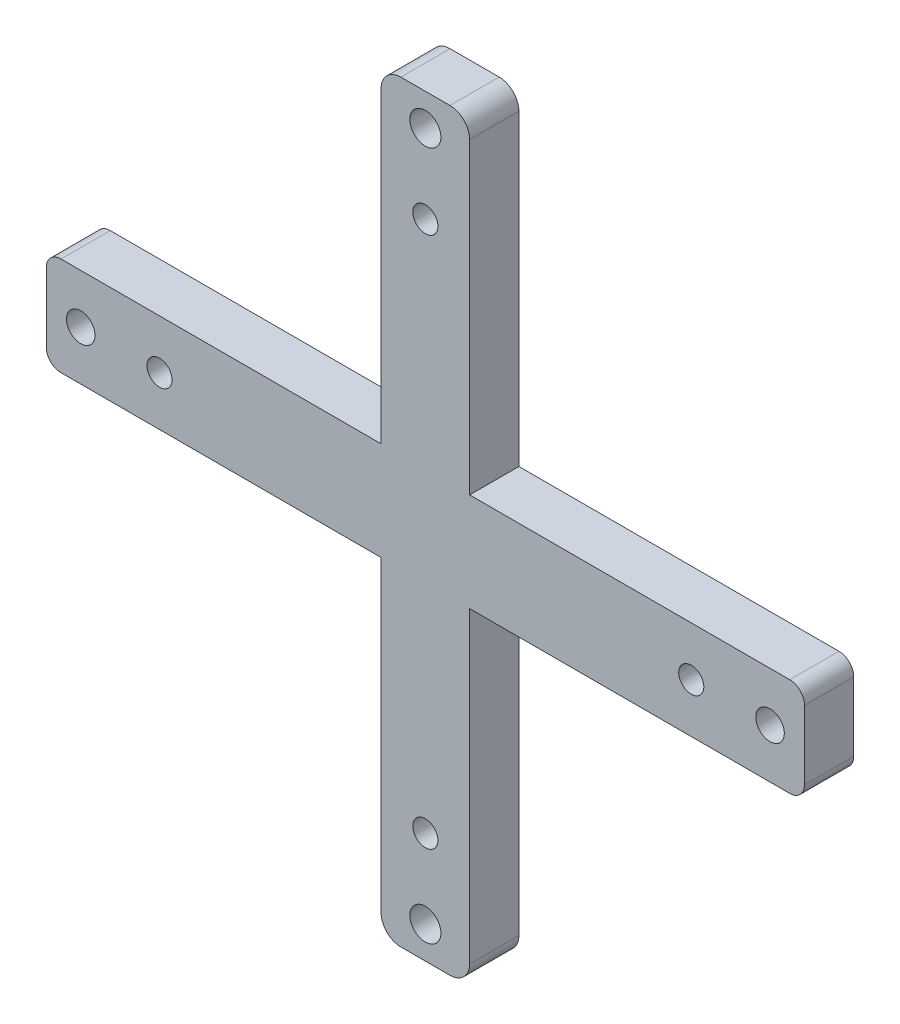
from build123d import *

# Parameters (mm, degrees)
SKETCH1_R           = 3.683
BOSS_EXTRUDE1_DEPTH = 12.7
SKETCH3_R           = 4
BOSS_EXTRUDE3_DEPTH = 12.7
SKETCH2_R           = 3.683
SKETCH2_R_2         = 4
BOSS_EXTRUDE2_DEPTH = 6.35
SKETCH4_R           = 3.2385
CUT_EXTRUDE1_DEPTH  = 139.431456414


with BuildPart() as part:
    # Sketch1 → Boss-Extrude1 (new body)
    with BuildSketch(Plane.XY):
        with BuildLine():
            Line((93.98, -12.7), (-93.98, -12.7))
            ThreePointArc((-93.98, -12.7), (-96.674076836, -11.584076836), (-97.79, -8.89))
            Line((-97.79, -8.89), (-97.79, 8.89))
            ThreePointArc((-97.79, 8.89), (-96.674076836, 11.584076836), (-93.98, 12.7))
            Line((-93.98, 12.7), (93.98, 12.7))
            ThreePointArc((93.98, 12.7), (96.674076836, 11.584076836), (97.79, 8.89))
            Line((97.79, 8.89), (97.79, -8.89))
            ThreePointArc((97.79, -8.89), (96.674076836, -11.584076836), (93.98, -12.7))
        make_face()
        with Locations((-88.9, 0)):
            Circle(SKETCH1_R, mode=Mode.SUBTRACT)
        with Locations((88.9, 0)):
            Circle(SKETCH1_R, mode=Mode.SUBTRACT)
    extrude(amount=BOSS_EXTRUDE1_DEPTH)

    # Sketch3 → Boss-Extrude3 (add, through all)
    with BuildSketch(Plane.XY.offset(12.7)):
        with BuildLine():
            Line((-6.335384206, -97.155), (6.335384206, -97.155))
            ThreePointArc((6.335384206, -97.155), (9.927486654, -95.667102448), (11.415384206, -92.075))
            Line((11.415384206, -92.075), (11.415384206, 92.075))
            ThreePointArc((11.415384206, 92.075), (9.927486654, 95.667102448), (6.335384206, 97.155))
            Line((6.335384206, 97.155), (-6.335384206, 97.155))
            ThreePointArc((-6.335384206, 97.155), (-9.927486654, 95.667102448), (-11.415384206, 92.075))
            Line((-11.415384206, 92.075), (-11.415384206, -92.075))
            ThreePointArc((-11.415384206, -92.075), (-9.927486654, -95.667102448), (-6.335384206, -97.155))
        make_face()
        with Locations((0, 88.9)):
            Circle(SKETCH3_R, mode=Mode.SUBTRACT)
        with Locations((0, -88.9)):
            Circle(SKETCH3_R, mode=Mode.SUBTRACT)
    extrude(amount=-BOSS_EXTRUDE3_DEPTH)

    # Sketch2 → Boss-Extrude2 (add)
    with BuildSketch(Plane(origin=(0, 0, 0), x_dir=(-1, 0, 0), z_dir=(0, 0, -1))):
        with Locations((-88.9, 0)):
            Circle(SKETCH2_R)
        with Locations((88.9, 0)):
            Circle(SKETCH2_R)
        with Locations(Location((0, 88.9, 0), (0, 0, 180))):
            Circle(SKETCH2_R_2)
        with Locations(Location((0, -88.9, 0), (0, 0, 180))):
            Circle(SKETCH2_R_2)
    extrude(amount=-BOSS_EXTRUDE2_DEPTH)

    # Sketch4 → Cut-Extrude1 (cut, through all)
    with BuildSketch(Plane.XY.offset(12.7)):
        with Locations((-68.58, 0)):
            Circle(SKETCH4_R)
        with Locations((0, 68.58)):
            Circle(SKETCH4_R)
        with Locations((68.58, 0)):
            Circle(SKETCH4_R)
        with Locations((0, -68.58)):
            Circle(SKETCH4_R)
    extrude(amount=-CUT_EXTRUDE1_DEPTH, mode=Mode.SUBTRACT)


solid = part.part
